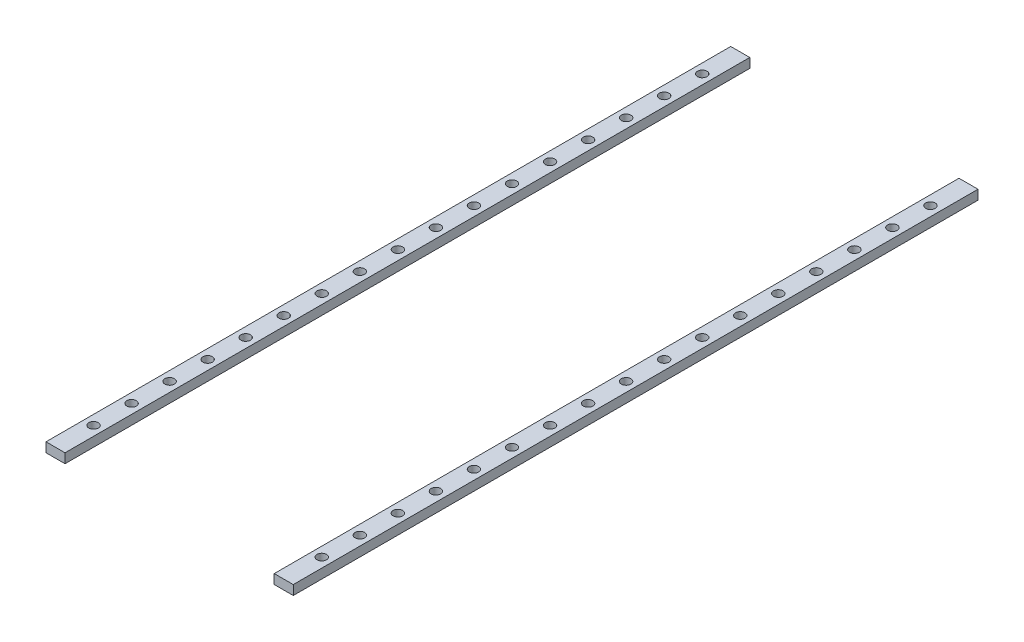
from build123d import *

# Parameters (mm, degrees)
SKETCH1_R             = 6.35
BOSS_EXTRUDE1_DEPTH   = 12.7
BOSS_EXTRUDE1_2_DEPTH = 12.7


with BuildPart() as part:
    # Sketch1 → Boss-Extrude1 (new body)
    with BuildSketch(Plane(origin=(0, 0, 0), x_dir=(1, 0, 0), z_dir=(0, 1, 0))):
        Polygon((152.4, 914.4), (165.1, 914.4), (165.1, 0), (139.7, 0), (139.7, 914.4), align=None)
        with Locations(Location((152.4, 50.8, 0), (0, 0, 270))):
            Circle(SKETCH1_R, mode=Mode.SUBTRACT)
        with Locations(Location((152.4, 101.6, 0), (0, 0, 270))):
            Circle(SKETCH1_R, mode=Mode.SUBTRACT)
        with Locations(Location((152.4, 152.4, 0), (0, 0, 270))):
            Circle(SKETCH1_R, mode=Mode.SUBTRACT)
        with Locations(Location((152.4, 203.2, 0), (0, 0, 270))):
            Circle(SKETCH1_R, mode=Mode.SUBTRACT)
        with Locations(Location((152.4, 254, 0), (0, 0, 270))):
            Circle(SKETCH1_R, mode=Mode.SUBTRACT)
        with Locations(Location((152.4, 304.8, 0), (0, 0, 270))):
            Circle(SKETCH1_R, mode=Mode.SUBTRACT)
        with Locations(Location((152.4, 355.6, 0), (0, 0, 270))):
            Circle(SKETCH1_R, mode=Mode.SUBTRACT)
        with Locations(Location((152.4, 406.4, 0), (0, 0, 270))):
            Circle(SKETCH1_R, mode=Mode.SUBTRACT)
        with Locations(Location((152.4, 457.2, 0), (0, 0, 270))):
            Circle(SKETCH1_R, mode=Mode.SUBTRACT)
        with Locations(Location((152.4, 508, 0), (0, 0, 270))):
            Circle(SKETCH1_R, mode=Mode.SUBTRACT)
        with Locations(Location((152.4, 558.8, 0), (0, 0, 270))):
            Circle(SKETCH1_R, mode=Mode.SUBTRACT)
        with Locations(Location((152.4, 609.6, 0), (0, 0, 270))):
            Circle(SKETCH1_R, mode=Mode.SUBTRACT)
        with Locations(Location((152.4, 660.4, 0), (0, 0, 270))):
            Circle(SKETCH1_R, mode=Mode.SUBTRACT)
        with Locations(Location((152.4, 711.2, 0), (0, 0, 270))):
            Circle(SKETCH1_R, mode=Mode.SUBTRACT)
        with Locations(Location((152.4, 762, 0), (0, 0, 270))):
            Circle(SKETCH1_R, mode=Mode.SUBTRACT)
        with Locations(Location((152.4, 812.8, 0), (0, 0, 270))):
            Circle(SKETCH1_R, mode=Mode.SUBTRACT)
        with Locations(Location((152.4, 863.6, 0), (0, 0, 270))):
            Circle(SKETCH1_R, mode=Mode.SUBTRACT)
    extrude(amount=BOSS_EXTRUDE1_DEPTH)


with BuildPart() as body_2:
    # Sketch1 → Boss-Extrude1 2 (new body)
    with BuildSketch(Plane(origin=(0, 0, 0), x_dir=(1, 0, 0), z_dir=(0, 1, 0))):
        Polygon((-165.1, 0), (-165.1, 914.4), (-152.4, 914.4), (-139.7, 914.4), (-139.7, 0), align=None)
        with Locations(Location((-152.4, 863.6, 0), (0, 0, 90))):
            Circle(SKETCH1_R, mode=Mode.SUBTRACT)
        with Locations(Location((-152.4, 812.8, 0), (0, 0, 90))):
            Circle(SKETCH1_R, mode=Mode.SUBTRACT)
        with Locations(Location((-152.4, 762, 0), (0, 0, 90))):
            Circle(SKETCH1_R, mode=Mode.SUBTRACT)
        with Locations(Location((-152.4, 711.2, 0), (0, 0, 90))):
            Circle(SKETCH1_R, mode=Mode.SUBTRACT)
        with Locations(Location((-152.4, 660.4, 0), (0, 0, 90))):
            Circle(SKETCH1_R, mode=Mode.SUBTRACT)
        with Locations(Location((-152.4, 609.6, 0), (0, 0, 90))):
            Circle(SKETCH1_R, mode=Mode.SUBTRACT)
        with Locations(Location((-152.4, 558.8, 0), (0, 0, 90))):
            Circle(SKETCH1_R, mode=Mode.SUBTRACT)
        with Locations(Location((-152.4, 508, 0), (0, 0, 90))):
            Circle(SKETCH1_R, mode=Mode.SUBTRACT)
        with Locations(Location((-152.4, 457.2, 0), (0, 0, 90))):
            Circle(SKETCH1_R, mode=Mode.SUBTRACT)
        with Locations(Location((-152.4, 406.4, 0), (0, 0, 90))):
            Circle(SKETCH1_R, mode=Mode.SUBTRACT)
        with Locations(Location((-152.4, 355.6, 0), (0, 0, 90))):
            Circle(SKETCH1_R, mode=Mode.SUBTRACT)
        with Locations(Location((-152.4, 304.8, 0), (0, 0, 90))):
            Circle(SKETCH1_R, mode=Mode.SUBTRACT)
        with Locations(Location((-152.4, 254, 0), (0, 0, 90))):
            Circle(SKETCH1_R, mode=Mode.SUBTRACT)
        with Locations(Location((-152.4, 203.2, 0), (0, 0, 90))):
            Circle(SKETCH1_R, mode=Mode.SUBTRACT)
        with Locations(Location((-152.4, 152.4, 0), (0, 0, 90))):
            Circle(SKETCH1_R, mode=Mode.SUBTRACT)
        with Locations(Location((-152.4, 101.6, 0), (0, 0, 90))):
            Circle(SKETCH1_R, mode=Mode.SUBTRACT)
        with Locations(Location((-152.4, 50.8, 0), (0, 0, 90))):
            Circle(SKETCH1_R, mode=Mode.SUBTRACT)
    extrude(amount=BOSS_EXTRUDE1_2_DEPTH)


solid = Compound([part.part, body_2.part])
